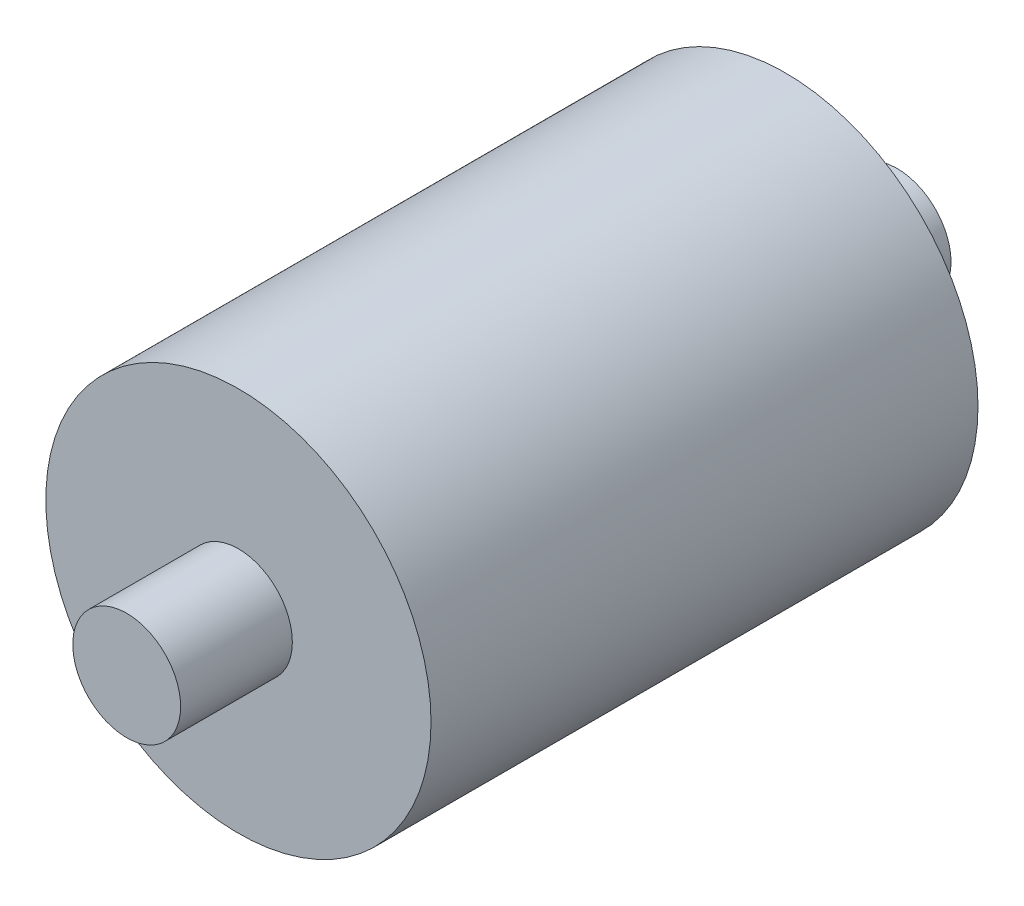
from build123d import *

# Parameters (mm, degrees)
CROQUIS1_R              = 25
SALIENTE_EXTRUIR1_DEPTH = 35.5
CROQUIS2_R              = 7
SALIENTE_EXTRUIR2_DEPTH = 50


with BuildPart() as part:
    # Croquis1 → Saliente-Extruir1 (new, symmetric)
    with BuildSketch(Plane.XY):
        Circle(CROQUIS1_R)
    extrude(amount=SALIENTE_EXTRUIR1_DEPTH, both=True)

    # Croquis2 → Saliente-Extruir2 (add, symmetric)
    with BuildSketch(Plane.XY):
        Circle(CROQUIS2_R)
    extrude(amount=SALIENTE_EXTRUIR2_DEPTH, both=True)


solid = part.part
